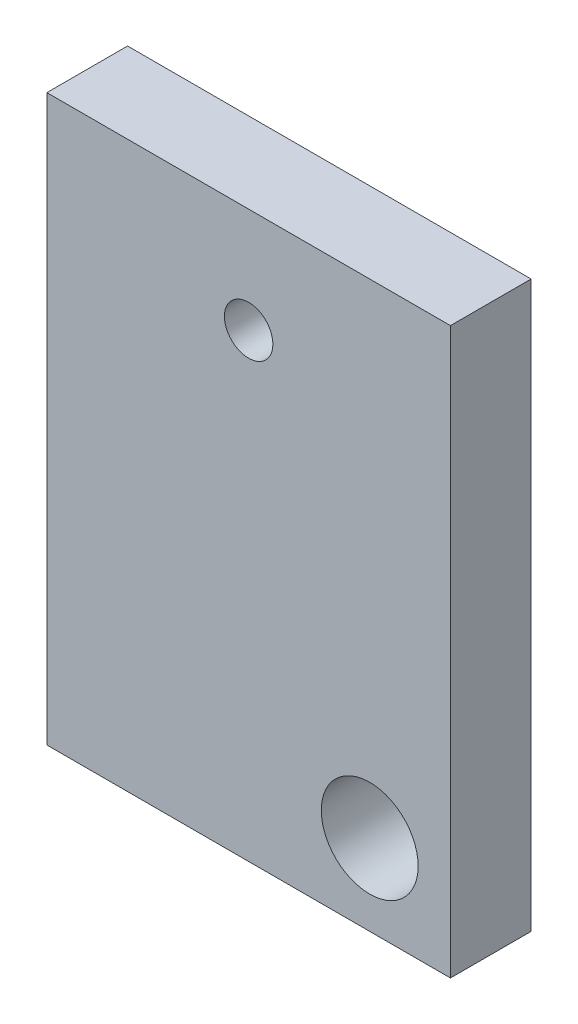
from build123d import *

# Parameters (mm, degrees)
SKETCH2_W           = 25
SKETCH2_H           = 35
BOSS_EXTRUDE1_DEPTH = 5
SKETCH4_R           = 1.5
CUT_EXTRUDE1_DEPTH  = 23.079402166
SKETCH6_R           = 3
CUT_EXTRUDE2_DEPTH  = 23.079402166


with BuildPart() as part:
    # Sketch2 → Boss-Extrude1 (new body)
    with BuildSketch(Plane.XY):
        Rectangle(SKETCH2_W, SKETCH2_H)
    extrude(amount=BOSS_EXTRUDE1_DEPTH)

    # Sketch4 → Cut-Extrude1 (cut, through all)
    with BuildSketch(Plane.XY.offset(5)):
        with Locations((0, 11)):
            Circle(SKETCH4_R)
    extrude(amount=-CUT_EXTRUDE1_DEPTH, mode=Mode.SUBTRACT)

    # Sketch6 → Cut-Extrude2 (cut, through all)
    with BuildSketch(Plane.XY.offset(5)):
        with Locations((7.5, -12.5)):
            Circle(SKETCH6_R)
    extrude(amount=-CUT_EXTRUDE2_DEPTH, mode=Mode.SUBTRACT)


solid = part.part
